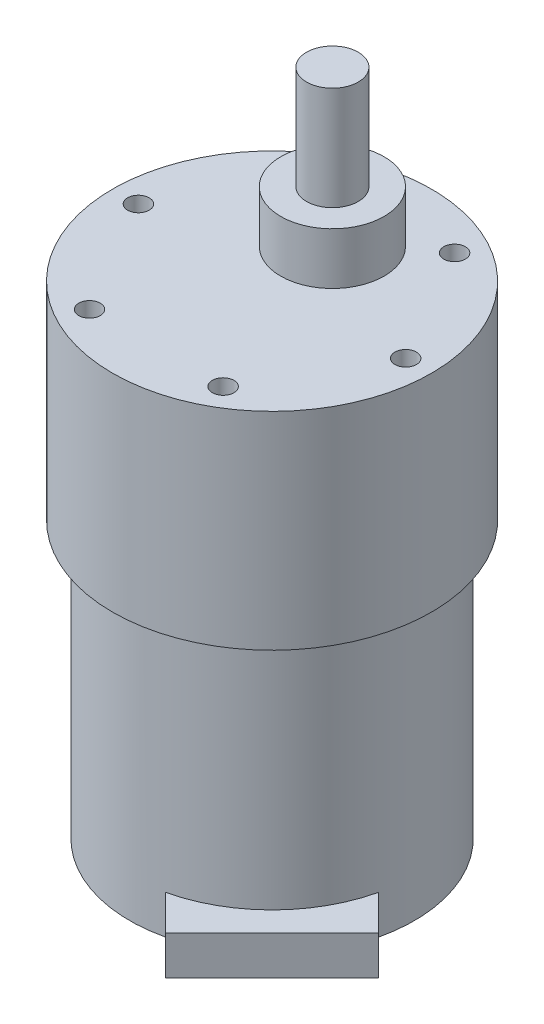
from build123d import *

# Parameters (mm, degrees)
SKETCH_1_R             = 16.5
EXTRUDE_1_DEPTH        = 32
SKETCH_2_R             = 18.5
EXTRUDE_2_DEPTH        = 24
SKETCH_3_R             = 6
EXTRUDE_3_DEPTH        = 6
SKETCH_4_R             = 3
EXTRUDE_4_DEPTH        = 12
HOLE_WIZARD_M3_1_D     = 2.5
HOLE_WIZARD_M3_1_DEPTH = 3.3
HOLE_WIZARD_M3_1_TIP   = 0.751075774
EXTRUDE_5_DEPTH        = 4.5


with BuildPart() as part:
    # 草图1 → 凸台-拉伸1 (new body)
    with BuildSketch(Plane(origin=(0, 0, 0), x_dir=(1, 0, 0), z_dir=(0, 1, 0))):
        with Locations(Location((0, 0, 0), (0, 0, 270))):
            Circle(SKETCH_1_R)
    extrude(amount=EXTRUDE_1_DEPTH)

    # 草图2 → 凸台-拉伸2 (add)
    with BuildSketch(Plane(origin=(0, 32, 0), x_dir=(1, 0, 0), z_dir=(0, 1, 0))):
        with Locations(Location((0, 0, 0), (0, 0, 270))):
            Circle(SKETCH_2_R)
    extrude(amount=EXTRUDE_2_DEPTH)

    # 草图3 → 凸台-拉伸3 (add)
    with BuildSketch(Plane(origin=(0, 56, 0), x_dir=(1, 0, 0), z_dir=(0, 1, 0))):
        with Locations(Location((0, 7, 0), (0, 0, 270))):
            Circle(SKETCH_3_R)
    extrude(amount=EXTRUDE_3_DEPTH)

    # 草图4 → 凸台-拉伸4 (add)
    with BuildSketch(Plane(origin=(0, 62, 0), x_dir=(1, 0, 0), z_dir=(0, 1, 0))):
        with Locations(Location((0, 7, 0), (0, 0, 270))):
            Circle(SKETCH_4_R)
    extrude(amount=EXTRUDE_4_DEPTH)

    # M3 螺纹孔的螺纹孔钻头1
    with Locations(Plane(origin=(0, 56, 0), x_dir=(1, 0, 0), z_dir=(0, 1, 0))):
        with Locations((-7.75, 13.423393759), (7.75, 13.423393759), (15.5, 0), (7.75, -13.423393759), (-7.75, -13.423393759), (-15.5, 0)):
            Hole(HOLE_WIZARD_M3_1_D / 2, depth=HOLE_WIZARD_M3_1_DEPTH)
            with Locations((0, 0, -(HOLE_WIZARD_M3_1_DEPTH + HOLE_WIZARD_M3_1_TIP / 2))):  # 118° drill point
                Cone(0, HOLE_WIZARD_M3_1_D / 2, HOLE_WIZARD_M3_1_TIP, mode=Mode.SUBTRACT)

    # 草图8 → 凸台-拉伸5 (add)
    with BuildSketch(Plane.XZ):
        Polygon((3.704415636, 16.078784307), (16.078784307, 3.704415636), (20.187898603, 7.813529932), (7.813529932, 20.187898603), align=None)
    extrude(amount=-EXTRUDE_5_DEPTH)


solid = part.part
